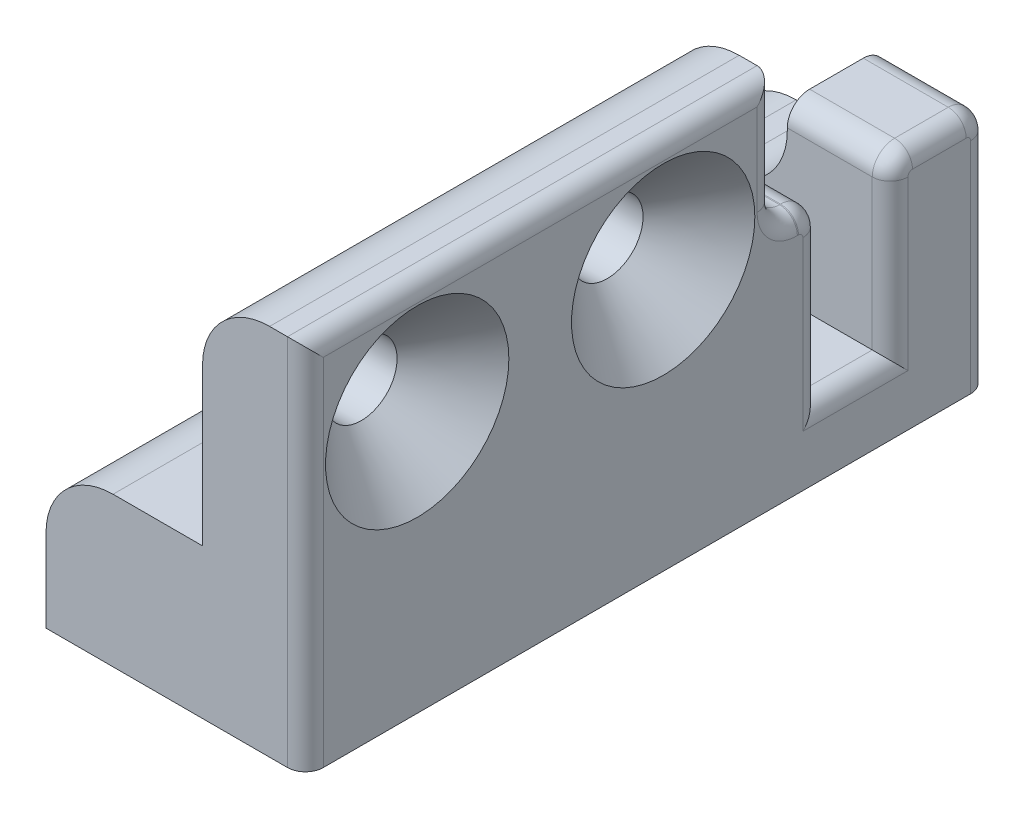
from build123d import *

# Parameters (mm, degrees)
BOSS_EXTRUDE1_DEPTH      = 6.686777
BOSS_EXTRUDE1_DEPTH_BACK = 0.0001
SKETCH1_W                = 11.6
SKETCH1_H                = 30.55
SKETCH2_W                = 4.6
SKETCH2_H                = 21
BOSS_EXTRUDE3_DEPTH      = 10
FILLET1_R                = 3
SKETCH3_W                = 4.6
SKETCH3_H                = 4.4
SKETCH3_H_2              = 2.05
BOSS_EXTRUDE4_DEPTH      = 4.113123252
SKETCH4_W                = 3.1
SKETCH4_H                = 3.586876748
CUT_EXTRUDE1_DEPTH       = 87.944077783
SKETCH5_R                = 1.6
CUT_EXTRUDE2_DEPTH       = 87.944077783
SKETCH6_R                = 1
CUT_EXTRUDE3_DEPTH       = 91.600623245
FILLET2_R                = 1
FILLET3_R                = 3
FILLET4_R                = 2
CHAMFER1_SIZE            = 2.5
FILLET5_R                = 0.8


with BuildPart() as part:
    # Sketch1 → Boss-Extrude1 (new, two sides: drawn at the far end of the back side and taken through both)
    with BuildSketch(Plane(origin=(0, 0, 0), x_dir=(1, 0, 0), z_dir=(0, 1, 0)).offset(-BOSS_EXTRUDE1_DEPTH_BACK)):
        with Locations((22.195659191, -69.260579157)):
            Rectangle(SKETCH1_W, SKETCH1_H)
    extrude(amount=BOSS_EXTRUDE1_DEPTH + BOSS_EXTRUDE1_DEPTH_BACK)

    # Sketch2 → Boss-Extrude3 (add)
    with BuildSketch(Plane(origin=(0, 6.686776748, 0), x_dir=(1, 0, 0), z_dir=(0, 1, 0))):
        with Locations((25.695659191, -74.035579157)):
            Rectangle(SKETCH2_W, SKETCH2_H)
    extrude(amount=BOSS_EXTRUDE3_DEPTH)

    # Fillet1
    fillet1_edges = [part.edges().sort_by_distance(p)[0] for p in [
        (23.395659191, 16.686776748, 74.035579157),
    ]]
    fillet(fillet1_edges, radius=FILLET1_R)

    # Sketch3 → Boss-Extrude4 (add)
    with BuildSketch(Plane(origin=(0, 6.686776748, 0), x_dir=(1, 0, 0), z_dir=(0, 1, 0))):
        with Locations((25.695659191, -56.185579157)):
            Rectangle(SKETCH3_W, SKETCH3_H)
        with Locations((25.695659191, -62.510579157)):
            Rectangle(SKETCH3_W, SKETCH3_H_2)
    extrude(amount=BOSS_EXTRUDE4_DEPTH)

    # Sketch4 → Cut-Extrude1 (cut, through all)
    with BuildSketch(Plane(origin=(27.995659191, 0, 0), x_dir=(0, 0, -1), z_dir=(1, 0, 0))):
        with Locations((-59.935579157, 4.893338374)):
            Rectangle(SKETCH4_W, SKETCH4_H)
    extrude(amount=-CUT_EXTRUDE1_DEPTH, mode=Mode.SUBTRACT)

    # Sketch5 → Cut-Extrude2 (cut, through all)
    with BuildSketch(Plane(origin=(27.995659191, 0, 0), x_dir=(0, 0, -1), z_dir=(1, 0, 0))):
        with Locations((-68.535579157, 11.686776748)):
            Circle(SKETCH5_R)
        with Locations((-79.535579157, 11.686776748)):
            Circle(SKETCH5_R)
    extrude(amount=-CUT_EXTRUDE2_DEPTH, mode=Mode.SUBTRACT)

    # Sketch6 → Cut-Extrude3 (cut, through all)
    with BuildSketch(Plane.XZ.offset(0.0001)):
        with Locations(Location((21.895659191, 59.935579157, 0), (0, 0, 270))):
            Circle(SKETCH6_R)
        with Locations(Location((21.895659191, 71.935579157, 0), (0, 0, 270))):
            Circle(SKETCH6_R)
    extrude(amount=-CUT_EXTRUDE3_DEPTH, mode=Mode.SUBTRACT)

    # Fillet2
    fillet2_edges = [part.edges().sort_by_distance(p)[0] for p in [
        (25.695659191, 10.7999, 58.385579157),
        (25.695659191, 10.7999, 53.985579157),
        (25.695659191, 10.7999, 61.485579157),
        (25.695659191, 10.7999, 63.535579157),
    ]]
    fillet(fillet2_edges, radius=FILLET2_R)

    # Fillet3
    fillet3_edges = [part.edges().sort_by_distance(p)[0] for p in [
        (16.395659191, 6.686777, 73.010579157),
        (16.395659191, 6.686777, 56.185579157),
        (23.395659191, 6.686776748, 56.185579157),
    ]]
    fillet(fillet3_edges, radius=FILLET3_R)

    # Fillet4
    fillet4_edges = [part.edges().sort_by_distance(p)[0] for p in [
        (16.395659191, 3.0999, 59.935579157),
    ]]
    fillet(fillet4_edges, radius=FILLET4_R)

    # Chamfer1
    chamfer1_edges = [part.edges().sort_by_distance(p)[0] for p in [
        (27.995659191, 11.686776748, 70.135579157),
        (27.995659191, 11.686776748, 81.135579157),
    ]]
    chamfer(chamfer1_edges, length=CHAMFER1_SIZE)

    # Fillet5
    fillet5_edges = [part.edges().sort_by_distance(p)[0] for p in [
        (27.995659191, 10.7999, 56.185579157),
        (27.995659191, 6.4499, 58.385579157),
        (27.995659191, 6.4499, 61.485579157),
        (27.995659191, 10.7999, 62.510579157),
        (27.995659191, 10.507006781, 58.092685938),
        (27.995659191, 10.507006781, 61.778472375),
        (27.995659191, 10.507006781, 54.278472375),
        (27.995659191, 11.092793218, 63.242685938),
        (27.995659191, 14.243338374, 63.535579157),
        (27.995659191, 16.686776748, 74.035579157),
        (27.995659191, 8.343338374, 84.535579157),
        (27.995659191, 4.8999, 53.985579157),
        (27.995659191, 3.0999, 59.935579157),
    ]]
    fillet(fillet5_edges, radius=FILLET5_R)


solid = part.part
